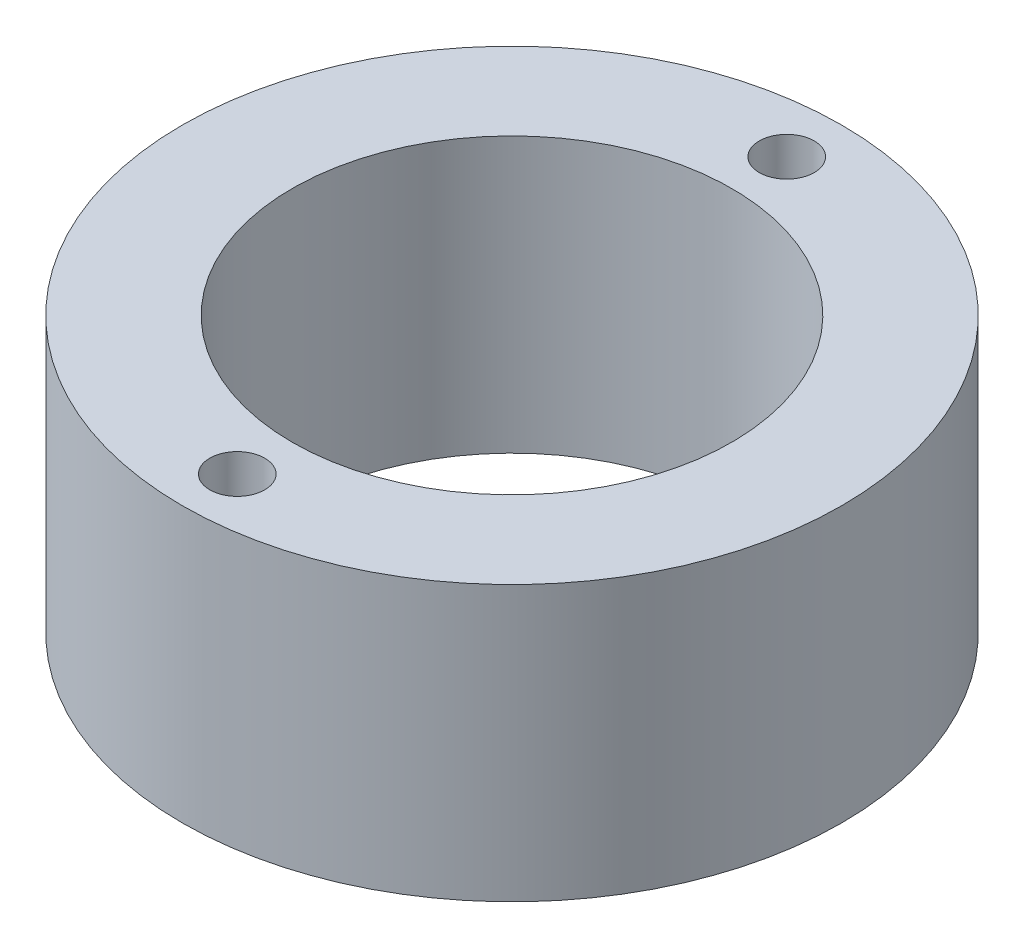
from build123d import *

# Parameters (mm, degrees)
SKETCH1_R           = 6
SKETCH1_R_2         = 4
SKETCH1_R_3         = 0.5
BOSS_EXTRUDE1_DEPTH = 5


with BuildPart() as part:
    # Sketch1 → Boss-Extrude1 (new body)
    with BuildSketch(Plane(origin=(0, 0, 0), x_dir=(1, 0, 0), z_dir=(0, 1, 0))):
        with Locations(Location((0, 0, 0), (0, 0, 270))):
            Circle(SKETCH1_R)
        with Locations(Location((0, 0, 0), (0, 0, 270))):
            Circle(SKETCH1_R_2, mode=Mode.SUBTRACT)
        with Locations(Location((0, 5, 0), (0, 0, 270))):
            Circle(SKETCH1_R_3, mode=Mode.SUBTRACT)
        with Locations(Location((0, -5, 0), (0, 0, 270))):
            Circle(SKETCH1_R_3, mode=Mode.SUBTRACT)
    extrude(amount=BOSS_EXTRUDE1_DEPTH)


solid = part.part
